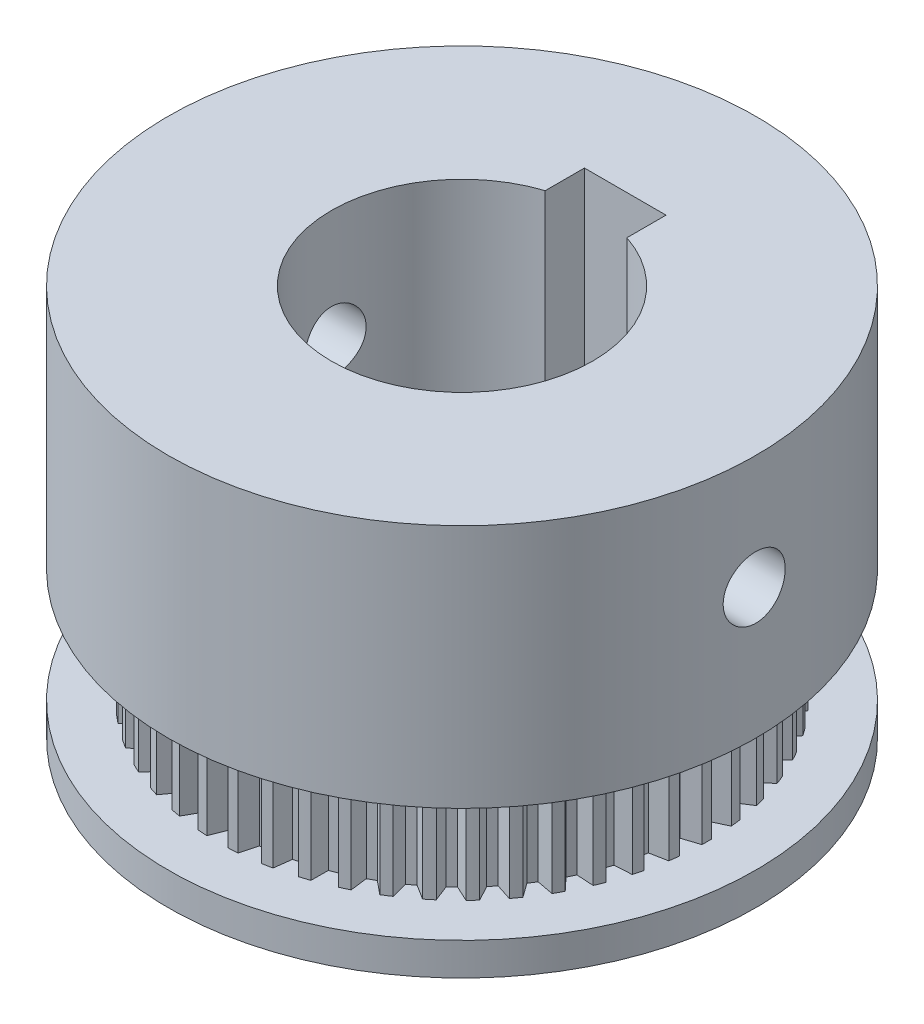
from build123d import *

# Parameters (mm, degrees)
SKETCH1_R               = 15
BOSS_EXTRUDE1_DEPTH     = 7
CUT_EXTRUDE1_DEPTH      = 23.338307904
BOSS_EXTRUDE2_START     = 2
SKETCH3_R               = 18
BOSS_EXTRUDE2_DEPTH     = 2
SKETCH4_R               = 18
BOSS_EXTRUDE3_DEPTH     = 15
CUT_EXTRUDE2_DEPTH      = 34.645207683
CUT_EXTRUDE2_DEPTH_BACK = 34.645207683
SKETCH5_R               = 1.9


with BuildPart() as part:
    # Sketch1 → Boss-Extrude1 (new body)
    with BuildSketch(Plane(origin=(0, 0, 0), x_dir=(1, 0, 0), z_dir=(0, 1, 0))):
        with Locations(Location((0, 0, 0), (0, 0, 270))):
            Circle(SKETCH1_R)
        with BuildLine():
            Line((-2.5, 7.599342077), (-2.5, 10))
            Line((-2.5, 10), (2.5, 10))
            Line((2.5, 10), (2.5, 7.599342077))
            ThreePointArc((2.5, 7.599342077), (0, -8), (-2.5, 7.599342077))
        make_face(mode=Mode.SUBTRACT)
    extrude(amount=BOSS_EXTRUDE1_DEPTH)

    # Sketch2 → Cut-Extrude1 (cut, through all)
    with BuildSketch(Plane(origin=(0, 7, 0), x_dir=(1, 0, 0), z_dir=(0, 1, 0))):
        Polygon((-0.65, 15), (-0.25, 14), (0.25, 14), (0.65, 15), align=None)
        Polygon((1.235123948, 14.963187122), (1.506636595, 13.920939127), (2.002693945, 13.85827251), (2.524873059, 14.800253918), align=None)
        Polygon((3.100769253, 14.690395844), (3.23951263, 13.622336728), (3.723804211, 13.497991784), (4.359927362, 14.36709899), align=None)
        Polygon((4.917513574, 14.185928248), (4.921299616, 13.108901941), (5.386187859, 12.924839664), (6.126223006, 13.707366329), align=None)
        Polygon((6.656705769, 13.457740089), (6.525474767, 12.388731939), (6.963628107, 12.147855102), (7.795904454, 12.831460312), align=None)
        Polygon((8.290917738, 12.51731533), (8.026739284, 11.473184234), (8.431247781, 11.179291608), (9.342639831, 11.753194502), align=None)
        Polygon((9.794376981, 11.37948503), (9.401417326, 10.37669756), (9.76590164, 10.034424007), (10.742036197, 10.489573792), align=None)
        Polygon((11.143373048, 10.062193454), (10.627829401, 9.116564167), (10.946541396, 8.731307546), (11.972024235, 9.060526238), align=None)
        Polygon((12.316631466, 8.586215076), (11.686634258, 7.712657111), (11.954547656, 7.290493148), (13.013206299, 7.488588773), align=None)
        Polygon((13.295649247, 6.974826958), (12.561133912, 6.187116845), (12.774023557, 5.734703319), (13.849162327, 5.798551789), align=None)
        Polygon((14.064986698, 5.253441651), (13.23753698, 4.56400205), (13.392045477, 4.088473792), (14.466708791, 4.01706818), align=None)
        Polygon((14.612510906, 3.449206432), (13.705176182, 2.868910217), (13.798866839, 2.377766592), (14.856106615, 2.172233006), align=None)
        Polygon((14.929587089, 1.590575166), (13.956676568, 1.128573956), (13.988071828, 0.629560591), (15.011214764, 0.293140419), align=None)
        Polygon((15.011214764, -0.293140419), (13.988071828, -0.629560591), (13.956676568, -1.128573956), (14.929587089, -1.590575166), align=None)
        Polygon((14.856106615, -2.172233006), (13.798866839, -2.377766592), (13.705176182, -2.868910217), (14.612510906, -3.449206432), align=None)
        Polygon((14.466708791, -4.01706818), (13.392045477, -4.088473792), (13.23753698, -4.56400205), (14.064986698, -5.253441651), align=None)
        Polygon((13.849162327, -5.798551789), (12.774023557, -5.734703319), (12.561133912, -6.187116845), (13.295649247, -6.974826958), align=None)
        Polygon((13.013206299, -7.488588773), (11.954547656, -7.290493148), (11.686634258, -7.712657111), (12.316631466, -8.586215076), align=None)
        Polygon((11.972024235, -9.060526238), (10.946541396, -8.731307546), (10.627829401, -9.116564167), (11.143373048, -10.062193454), align=None)
        Polygon((10.742036197, -10.489573792), (9.76590164, -10.034424007), (9.401417326, -10.37669756), (9.794376981, -11.37948503), align=None)
        Polygon((9.342639831, -11.753194502), (8.431247781, -11.179291608), (8.026739284, -11.473184234), (8.290917738, -12.51731533), align=None)
        Polygon((7.795904454, -12.831460312), (6.963628107, -12.147855102), (6.525474767, -12.388731939), (6.656705769, -13.457740089), align=None)
        Polygon((6.126223006, -13.707366329), (5.386187859, -12.924839664), (4.921299616, -13.108901941), (4.917513574, -14.185928248), align=None)
        Polygon((4.359927362, -14.36709899), (3.723804211, -13.497991784), (3.23951263, -13.622336728), (3.100769253, -14.690395844), align=None)
        Polygon((2.524873059, -14.800253918), (2.002693945, -13.85827251), (1.506636595, -13.920939127), (1.235123948, -14.963187122), align=None)
        Polygon((0.65, -15), (0.25, -14), (-0.25, -14), (-0.65, -15), align=None)
        Polygon((-1.235123948, -14.963187122), (-1.506636595, -13.920939127), (-2.002693945, -13.85827251), (-2.524873059, -14.800253918), align=None)
        Polygon((-3.100769253, -14.690395844), (-3.23951263, -13.622336728), (-3.723804211, -13.497991784), (-4.359927362, -14.36709899), align=None)
        Polygon((-4.917513574, -14.185928248), (-4.921299616, -13.108901941), (-5.386187859, -12.924839664), (-6.126223006, -13.707366329), align=None)
        Polygon((-6.656705769, -13.457740089), (-6.525474767, -12.388731939), (-6.963628107, -12.147855102), (-7.795904454, -12.831460312), align=None)
        Polygon((-8.290917738, -12.51731533), (-8.026739283, -11.473184234), (-8.431247781, -11.179291608), (-9.342639831, -11.753194502), align=None)
        Polygon((-9.794376981, -11.37948503), (-9.401417326, -10.37669756), (-9.76590164, -10.034424007), (-10.742036197, -10.489573792), align=None)
        Polygon((-11.143373048, -10.062193454), (-10.627829401, -9.116564167), (-10.946541396, -8.731307546), (-11.972024235, -9.060526238), align=None)
        Polygon((-12.316631466, -8.586215076), (-11.686634258, -7.712657111), (-11.954547656, -7.290493148), (-13.013206299, -7.488588773), align=None)
        Polygon((-13.295649247, -6.974826958), (-12.561133912, -6.187116845), (-12.774023557, -5.734703319), (-13.849162327, -5.798551789), align=None)
        Polygon((-14.064986698, -5.253441651), (-13.23753698, -4.56400205), (-13.392045477, -4.088473792), (-14.466708791, -4.01706818), align=None)
        Polygon((-14.612510906, -3.449206432), (-13.705176182, -2.868910217), (-13.798866839, -2.377766592), (-14.856106615, -2.172233006), align=None)
        Polygon((-14.929587089, -1.590575166), (-13.956676568, -1.128573956), (-13.988071828, -0.629560591), (-15.011214764, -0.293140419), align=None)
        Polygon((-15.011214764, 0.293140419), (-13.988071828, 0.629560591), (-13.956676568, 1.128573956), (-14.929587089, 1.590575166), align=None)
        Polygon((-14.856106615, 2.172233006), (-13.798866839, 2.377766592), (-13.705176182, 2.868910217), (-14.612510906, 3.449206432), align=None)
        Polygon((-14.466708791, 4.01706818), (-13.392045477, 4.088473792), (-13.23753698, 4.56400205), (-14.064986698, 5.253441651), align=None)
        Polygon((-13.849162327, 5.798551789), (-12.774023557, 5.734703319), (-12.561133912, 6.187116845), (-13.295649247, 6.974826958), align=None)
        Polygon((-13.013206299, 7.488588773), (-11.954547656, 7.290493148), (-11.686634258, 7.712657111), (-12.316631466, 8.586215076), align=None)
        Polygon((-11.972024235, 9.060526238), (-10.946541396, 8.731307546), (-10.627829401, 9.116564167), (-11.143373048, 10.062193454), align=None)
        Polygon((-10.742036197, 10.489573792), (-9.76590164, 10.034424007), (-9.401417326, 10.37669756), (-9.794376981, 11.37948503), align=None)
        Polygon((-9.342639831, 11.753194502), (-8.431247781, 11.179291608), (-8.026739284, 11.473184234), (-8.290917738, 12.51731533), align=None)
        Polygon((-7.795904454, 12.831460312), (-6.963628107, 12.147855102), (-6.525474767, 12.388731939), (-6.656705769, 13.457740089), align=None)
        Polygon((-6.126223006, 13.707366329), (-5.386187859, 12.924839664), (-4.921299616, 13.108901941), (-4.917513574, 14.185928248), align=None)
        Polygon((-4.359927362, 14.36709899), (-3.723804211, 13.497991784), (-3.23951263, 13.622336728), (-3.100769253, 14.690395844), align=None)
        Polygon((-2.524873059, 14.800253918), (-2.002693945, 13.85827251), (-1.506636595, 13.920939127), (-1.235123948, 14.963187122), align=None)
    extrude(amount=-CUT_EXTRUDE1_DEPTH, mode=Mode.SUBTRACT)

    # Sketch3 → Boss-Extrude2 (add)
    with BuildSketch(Plane.XZ.offset(BOSS_EXTRUDE2_START)):
        with Locations(Location((0, 0, 0), (0, 0, 270))):
            Circle(SKETCH3_R)
        with BuildLine():
            Line((-2.5, -7.599342077), (-2.5, -10))
            Line((-2.5, -10), (2.5, -10))
            Line((2.5, -10), (2.5, -7.599342077))
            ThreePointArc((2.5, -7.599342077), (0, 8), (-2.5, -7.599342077))
        make_face(mode=Mode.SUBTRACT)
    extrude(amount=-BOSS_EXTRUDE2_DEPTH)

    # Sketch4 → Boss-Extrude3 (add)
    with BuildSketch(Plane(origin=(0, 7, 0), x_dir=(1, 0, 0), z_dir=(0, 1, 0))):
        with Locations(Location((0, 0, 0), (0, 0, 90))):
            Circle(SKETCH4_R)
        with BuildLine():
            Line((-2.5, 7.599342077), (-2.5, 10))
            Line((-2.5, 10), (2.5, 10))
            Line((2.5, 10), (2.5, 7.599342077))
            ThreePointArc((2.5, 7.599342077), (0, -8), (-2.5, 7.599342077))
        make_face(mode=Mode.SUBTRACT)
    extrude(amount=BOSS_EXTRUDE3_DEPTH)

    # Sketch5 → Cut-Extrude2 (cut, two sides: drawn at the far end of the back side and taken through both)
    with BuildSketch(Plane(origin=(0, 0, 0), x_dir=(0, 0, -1), z_dir=(1, 0, 0)).offset(-CUT_EXTRUDE2_DEPTH_BACK)):
        with Locations((0, 15)):
            Circle(SKETCH5_R)
    extrude(amount=CUT_EXTRUDE2_DEPTH + CUT_EXTRUDE2_DEPTH_BACK, mode=Mode.SUBTRACT)


solid = part.part
